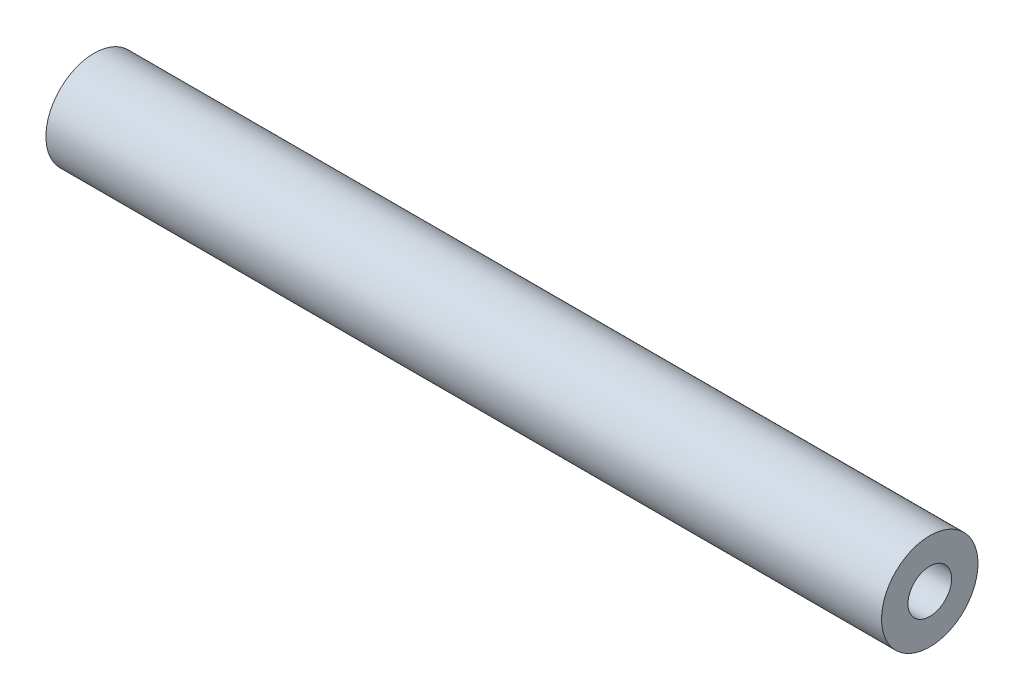
from build123d import *

# Parameters (mm, degrees)
SKETCH1_R           = 4.7625
SKETCH1_R_2         = 2.15265
BOSS_EXTRUDE1_DEPTH = 82.55


with BuildPart() as part:
    # Sketch1 → Boss-Extrude1 (new body)
    with BuildSketch(Plane(origin=(0, 0, 0), x_dir=(0, 0, -1), z_dir=(1, 0, 0))):
        Circle(SKETCH1_R)
        Circle(SKETCH1_R_2, mode=Mode.SUBTRACT)
    extrude(amount=BOSS_EXTRUDE1_DEPTH)


solid = part.part
